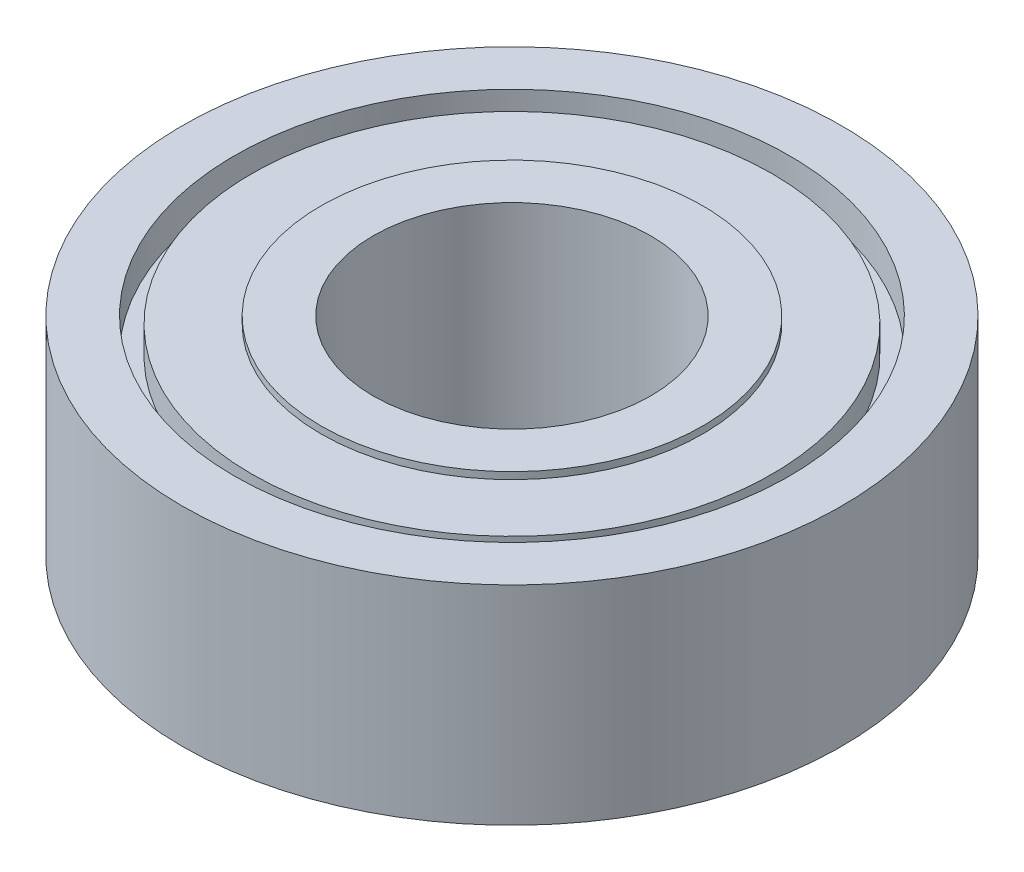
from build123d import *

# Parameters (mm, degrees)
SKETCH1_R           = 5.5
SKETCH1_R_2         = 4
BOSS_EXTRUDE1_DEPTH = 3
SKETCH3_R           = 7.5
SKETCH3_R_2         = 5.5
BOSS_EXTRUDE2_DEPTH = 2.8
SKETCH4_R           = 8
SKETCH4_R_2         = 7.5
BOSS_EXTRUDE3_DEPTH = 2
SKETCH5_R           = 9.5
SKETCH5_R_2         = 8
BOSS_EXTRUDE4_DEPTH = 3


with BuildPart() as part:
    # Sketch1 → Boss-Extrude1 (new, symmetric)
    with BuildSketch(Plane(origin=(0, 0, 0), x_dir=(1, 0, 0), z_dir=(0, 1, 0))):
        with Locations(Location((0, 0, 0), (0, 0, 270))):
            Circle(SKETCH1_R)
        with Locations(Location((0, 0, 0), (0, 0, 270))):
            Circle(SKETCH1_R_2, mode=Mode.SUBTRACT)
    extrude(amount=BOSS_EXTRUDE1_DEPTH, both=True)

    # Sketch3 → Boss-Extrude2 (add, symmetric)
    with BuildSketch(Plane(origin=(0, 0, 0), x_dir=(1, 0, 0), z_dir=(0, 1, 0))):
        with Locations(Location((0, 0, 0), (0, 0, 270))):
            Circle(SKETCH3_R)
        with Locations(Location((0, 0, 0), (0, 0, 270))):
            Circle(SKETCH3_R_2, mode=Mode.SUBTRACT)
    extrude(amount=BOSS_EXTRUDE2_DEPTH, both=True)

    # Sketch4 → Boss-Extrude3 (add, symmetric)
    with BuildSketch(Plane(origin=(0, 0, 0), x_dir=(1, 0, 0), z_dir=(0, 1, 0))):
        with Locations(Location((0, 0, 0), (0, 0, 270))):
            Circle(SKETCH4_R)
        with Locations(Location((0, 0, 0), (0, 0, 270))):
            Circle(SKETCH4_R_2, mode=Mode.SUBTRACT)
    extrude(amount=BOSS_EXTRUDE3_DEPTH, both=True)

    # Sketch5 → Boss-Extrude4 (add, symmetric)
    with BuildSketch(Plane(origin=(0, 0, 0), x_dir=(1, 0, 0), z_dir=(0, 1, 0))):
        with Locations(Location((0, 0, 0), (0, 0, 270))):
            Circle(SKETCH5_R)
        with Locations(Location((0, 0, 0), (0, 0, 270))):
            Circle(SKETCH5_R_2, mode=Mode.SUBTRACT)
    extrude(amount=BOSS_EXTRUDE4_DEPTH, both=True)


solid = part.part
